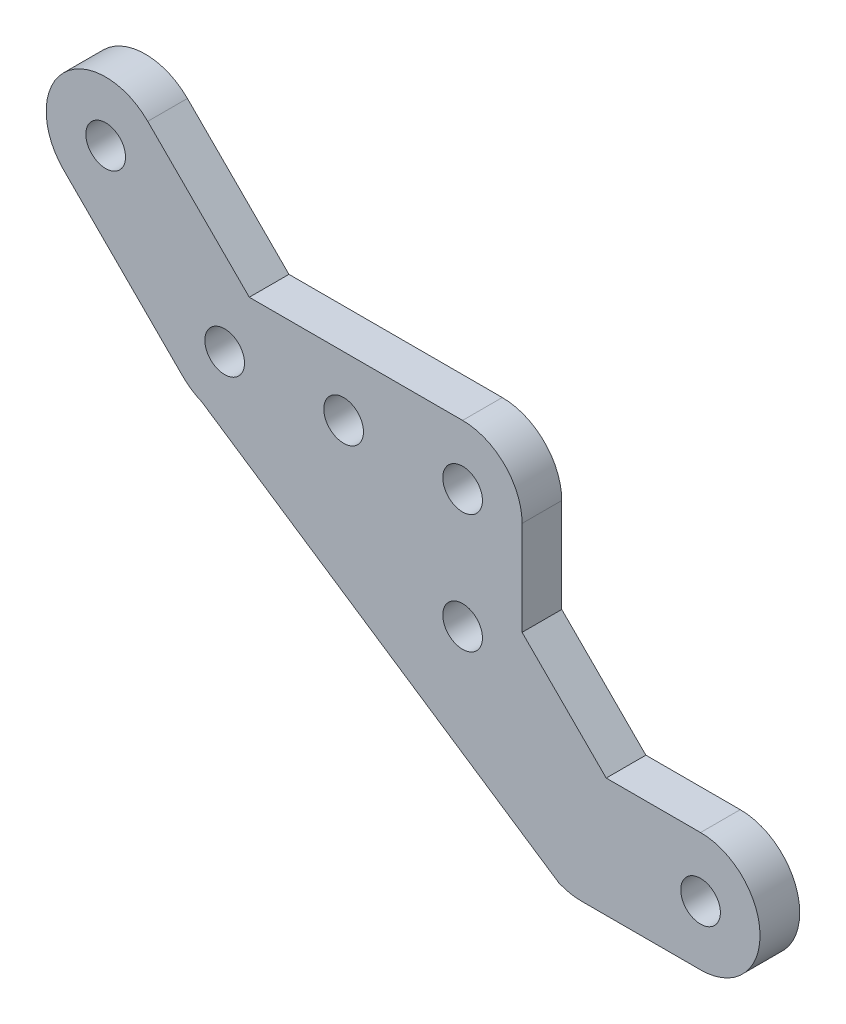
from build123d import *

# Parameters (mm, degrees)
MODEL_R                 = 1.5
SALIENTE_EXTRUIR1_DEPTH = 3


with BuildPart() as part:
    # Model → Saliente-Extruir1 (new body)
    with BuildSketch(Plane.XY):
        with BuildLine():
            Line((365.001663828, 201.955720999), (348.865624859, 201.955720999))
            Line((348.865624859, 201.955720999), (341.183644344, 209.637701515))
            ThreePointArc((341.183644344, 209.637701515), (334.819683313, 209.637701515), (334.819683313, 203.273740484))
            Line((334.819683313, 203.273740484), (343.819683313, 194.273740484))
            ThreePointArc((343.819683313, 194.273740484), (344.50159778, 193.714107744), (345.279588383, 193.298263103))
            Line((345.279588383, 193.298263103), (370.826347096, 176.267090628))
            Line((370.826347096, 176.267090628), (372.279588383, 175.298263103))
            ThreePointArc((372.279588383, 175.298263103), (373.123757379, 175.042187237), (374.001663828, 174.955720999))
            Line((374.001663828, 174.955720999), (383.001663828, 174.955720999))
            ThreePointArc((383.001663828, 174.955720999), (387.501663828, 179.455720999), (383.001663828, 183.955720999))
            Line((383.001663828, 183.955720999), (375.865624859, 183.955720999))
            Line((375.865624859, 183.955720999), (369.501663828, 190.31968203))
            Line((369.501663828, 190.31968203), (369.501663828, 197.455720999))
            ThreePointArc((369.501663828, 197.455720999), (368.183644344, 200.637701515), (365.001663828, 201.955720999))
        make_face()
        with Locations((383.001663828, 179.455720999)):
            Circle(MODEL_R, mode=Mode.SUBTRACT)
        with Locations((365.001663828, 188.455720999)):
            Circle(MODEL_R, mode=Mode.SUBTRACT)
        with Locations((347.001663829, 197.455720999)):
            Circle(MODEL_R, mode=Mode.SUBTRACT)
        with Locations((356.001663828, 197.455720999)):
            Circle(MODEL_R, mode=Mode.SUBTRACT)
        with Locations((338.001663828, 206.455720999)):
            Circle(MODEL_R, mode=Mode.SUBTRACT)
        with Locations((365.001663828, 197.455720999)):
            Circle(MODEL_R, mode=Mode.SUBTRACT)
    extrude(amount=SALIENTE_EXTRUIR1_DEPTH)


solid = part.part
